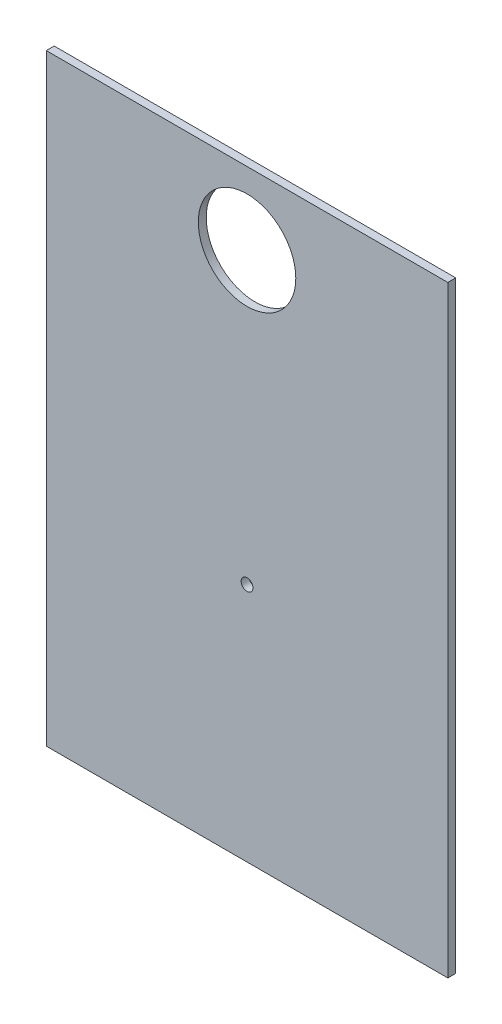
from build123d import *

# Parameters (mm, degrees)
SKETCH1_W           = 304.8
SKETCH1_H           = 457.2
BOSS_EXTRUDE1_DEPTH = 6
SKETCH2_R           = 37
CUT_EXTRUDE1_DEPTH  = 275.808515152
SKETCH3_R           = 4.5
CUT_EXTRUDE2_DEPTH  = 275.808515152


with BuildPart() as part:
    # Sketch1 → Boss-Extrude1 (new body)
    with BuildSketch(Plane.XY):
        Rectangle(SKETCH1_W, SKETCH1_H)
    extrude(amount=BOSS_EXTRUDE1_DEPTH)

    # Sketch2 → Cut-Extrude1 (cut, through all)
    with BuildSketch(Plane.XY.offset(6)):
        with Locations((0, 173.6)):
            Circle(SKETCH2_R)
    extrude(amount=-CUT_EXTRUDE1_DEPTH, mode=Mode.SUBTRACT)

    # Sketch3 → Cut-Extrude2 (cut, through all)
    with BuildSketch(Plane.XY.offset(6)):
        with Locations((0, -46.2)):
            Circle(SKETCH3_R)
    extrude(amount=-CUT_EXTRUDE2_DEPTH, mode=Mode.SUBTRACT)


solid = part.part
